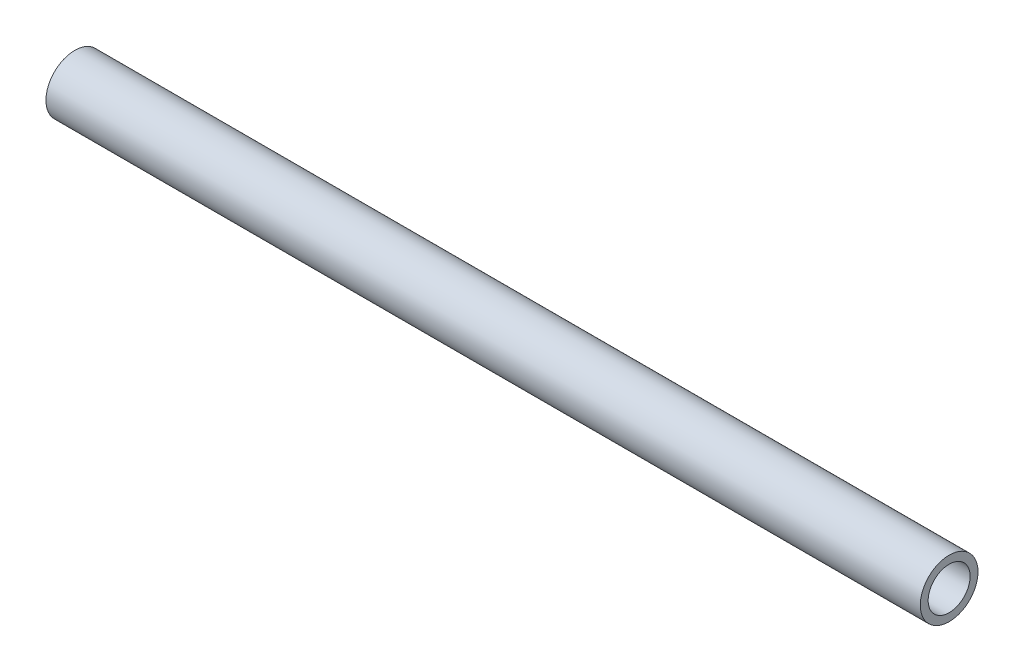
from build123d import *

# Parameters (mm, degrees)
SKETCH1_R           = 4.125
SKETCH1_R_2         = 3
BOSS_EXTRUDE1_DEPTH = 125


with BuildPart() as part:
    # Sketch1 → Boss-Extrude1 (new body)
    with BuildSketch(Plane(origin=(0, 0, 0), x_dir=(0, 0, -1), z_dir=(1, 0, 0))):
        Circle(SKETCH1_R)
        Circle(SKETCH1_R_2, mode=Mode.SUBTRACT)
    extrude(amount=BOSS_EXTRUDE1_DEPTH)


solid = part.part
